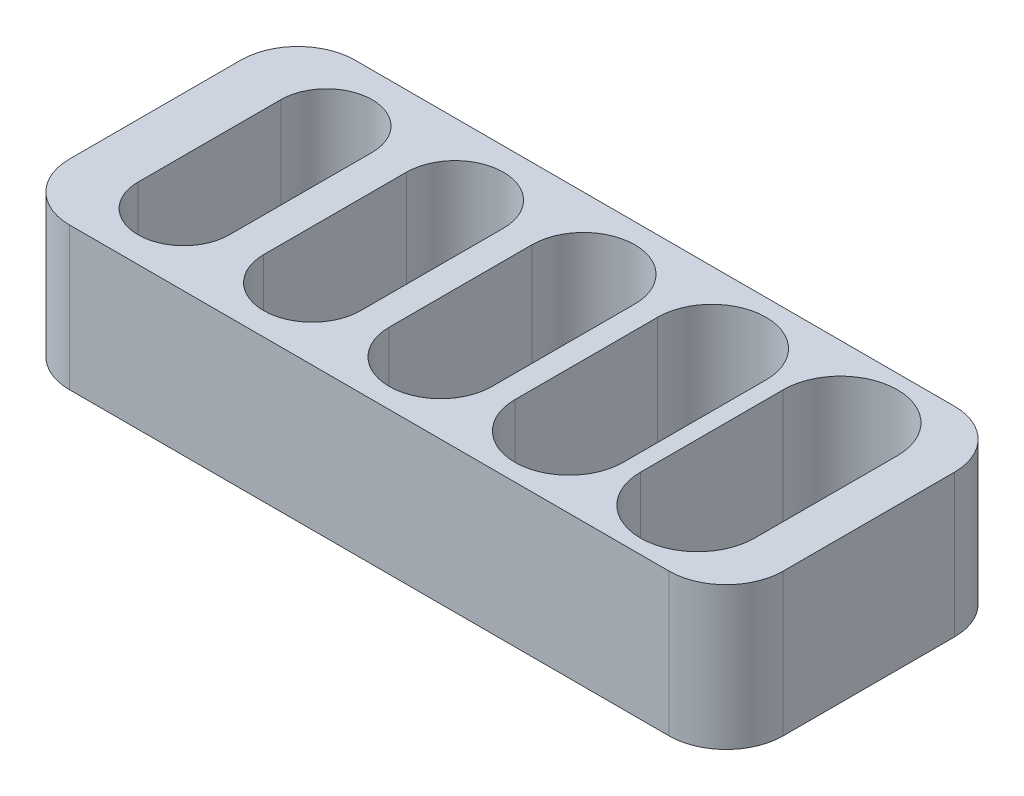
from build123d import *

# Parameters (mm, degrees)
SKETCH1_W           = 25
SKETCH1_H           = 10
BOSS_EXTRUDE1_DEPTH = 5
FILLET1_R           = 2


with BuildPart() as part:
    # Sketch1 → Boss-Extrude1 (new body)
    with BuildSketch(Plane(origin=(0, 0, 0), x_dir=(1, 0, 0), z_dir=(0, 1, 0))):
        Rectangle(SKETCH1_W, SKETCH1_H)
        with BuildLine():
            Line((-1.8, -2.5), (-1.8, 2.5))
            ThreePointArc((-1.8, 2.5), (0, 4.3), (1.8, 2.5))
            Line((1.8, 2.5), (1.8, -2.5))
            ThreePointArc((1.8, -2.5), (0, -4.3), (-1.8, -2.5))
        make_face(mode=Mode.SUBTRACT)
        with BuildLine():
            Line((-6.2, -2.5), (-6.2, 2.5))
            ThreePointArc((-6.2, 2.5), (-4.5, 4.2), (-2.8, 2.5))
            Line((-2.8, 2.5), (-2.8, -2.5))
            ThreePointArc((-2.8, -2.5), (-4.5, -4.2), (-6.2, -2.5))
        make_face(mode=Mode.SUBTRACT)
        with BuildLine():
            Line((-10.6, -2.5), (-10.6, 2.5))
            ThreePointArc((-10.6, 2.5), (-9, 4.1), (-7.4, 2.5))
            Line((-7.4, 2.5), (-7.4, -2.5))
            ThreePointArc((-7.4, -2.5), (-9, -4.1), (-10.6, -2.5))
        make_face(mode=Mode.SUBTRACT)
        with BuildLine():
            Line((2.6, -2.5), (2.6, 2.5))
            ThreePointArc((2.6, 2.5), (4.5, 4.4), (6.4, 2.5))
            Line((6.4, 2.5), (6.4, -2.5))
            ThreePointArc((6.4, -2.5), (4.5, -4.4), (2.6, -2.5))
        make_face(mode=Mode.SUBTRACT)
        with BuildLine():
            Line((7, -2.5), (7, 2.5))
            ThreePointArc((7, 2.5), (9, 4.5), (11, 2.5))
            Line((11, 2.5), (11, -2.5))
            ThreePointArc((11, -2.5), (9, -4.5), (7, -2.5))
        make_face(mode=Mode.SUBTRACT)
    extrude(amount=BOSS_EXTRUDE1_DEPTH)

    # Fillet1
    fillet1_edges = [part.edges().sort_by_distance(p)[0] for p in [
        (-12.5, 2.5, -5),
        (12.5, 2.5, -5),
        (12.5, 2.5, 5),
        (-12.5, 2.5, 5),
    ]]
    fillet(fillet1_edges, radius=FILLET1_R)


solid = part.part
